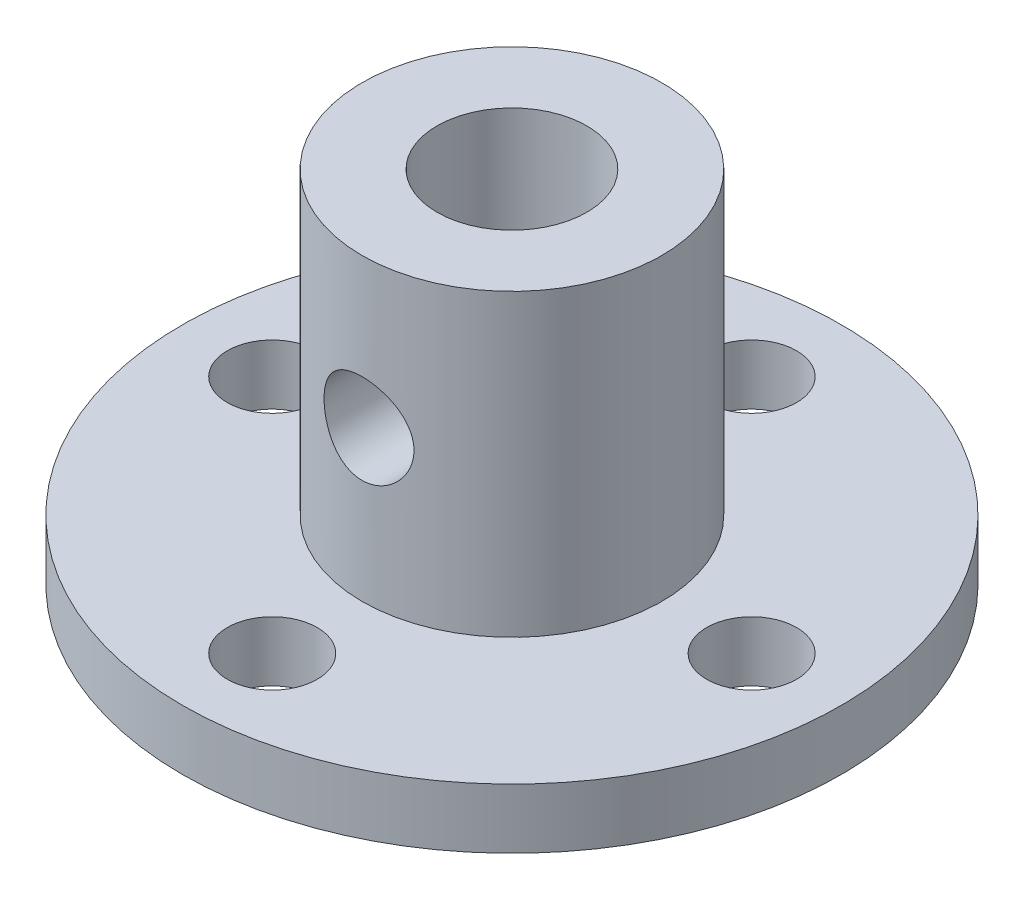
from build123d import *

# Parameters (mm, degrees)
SKETCH_1_R               = 11
EXTRUDE_1_DEPTH          = 2
SKETCH_2_R               = 1.5
CUT_EXTRUDE_1_DEPTH      = 2
SKETCH_3_R               = 5
EXTRUDE_2_DEPTH          = 10
SKETCH_4_R               = 2.5
CUT_EXTRUDE_2_DEPTH      = 12
CUT_EXTRUDE_4_DEPTH      = 5
CUT_EXTRUDE_4_DEPTH_BACK = 5
SKETCH_5_R               = 1.5


with BuildPart() as part:
    # 草图1 → 凸台-拉伸1 (new body)
    with BuildSketch(Plane(origin=(0, 0, 0), x_dir=(1, 0, 0), z_dir=(0, 1, 0))):
        Circle(SKETCH_1_R)
    extrude(amount=EXTRUDE_1_DEPTH)

    # 草图2 → 切除-拉伸1 (cut)
    with BuildSketch(Plane.XZ):
        with Locations((0, -8)):
            Circle(SKETCH_2_R)
        with Locations((8, 0)):
            Circle(SKETCH_2_R)
        with Locations((-8, 0)):
            Circle(SKETCH_2_R)
        with Locations((0, 8)):
            Circle(SKETCH_2_R)
    extrude(amount=-CUT_EXTRUDE_1_DEPTH, mode=Mode.SUBTRACT)

    # 草图3 → 凸台-拉伸2 (add)
    with BuildSketch(Plane(origin=(0, 2, 0), x_dir=(1, 0, 0), z_dir=(0, 1, 0))):
        Circle(SKETCH_3_R)
    extrude(amount=EXTRUDE_2_DEPTH)

    # 草图4 → 切除-拉伸2 (cut)
    with BuildSketch(Plane(origin=(0, 12, 0), x_dir=(1, 0, 0), z_dir=(0, 1, 0))):
        Circle(SKETCH_4_R)
    extrude(amount=-CUT_EXTRUDE_2_DEPTH, mode=Mode.SUBTRACT)

    # 草图5 → 切除-拉伸4 (cut, two sides: drawn at the far end of the back side and taken through both)
    with BuildSketch(Plane.XY.offset(-CUT_EXTRUDE_4_DEPTH_BACK)):
        with Locations((0, 7)):
            Circle(SKETCH_5_R)
    extrude(amount=CUT_EXTRUDE_4_DEPTH + CUT_EXTRUDE_4_DEPTH_BACK, mode=Mode.SUBTRACT)


solid = part.part
